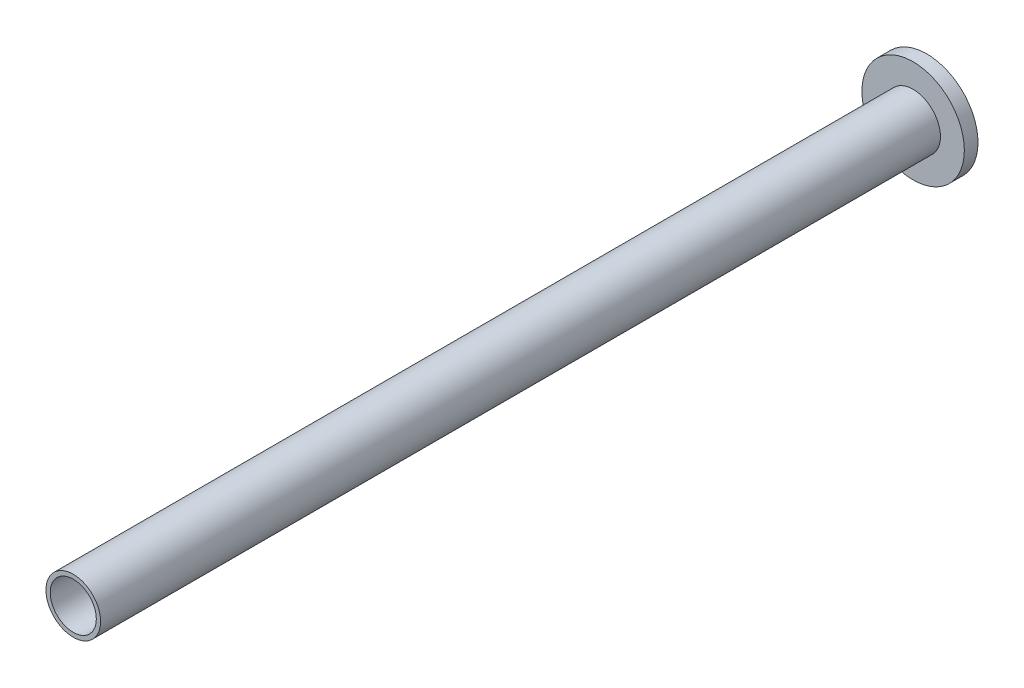
from build123d import *

# Parameters (mm, degrees)
EXTRUDE_START        = 300
EXTRUDE_SKETCH_1_R   = 30
EXTRUDE_1_DEPTH      = 8
EXTRUDE_START_2      = 308
EXTRUDE_SKETCH_2_R   = 16
EXTRUDE_SKETCH_2_R_2 = 13.5
EXTRUDE_2_DEPTH      = 492


with BuildPart() as part:
    # Extrude sketch 1 → Extrude 1 (new body)
    with BuildSketch(Plane.XY.offset(EXTRUDE_START)):
        with Locations((860, 225)):
            Circle(EXTRUDE_SKETCH_1_R)
    extrude(amount=EXTRUDE_1_DEPTH)


with BuildPart() as body_2:
    # Extrude sketch 2 → Extrude 2 (new body)
    with BuildSketch(Plane.XY.offset(EXTRUDE_START_2)):
        with Locations((860, 225)):
            Circle(EXTRUDE_SKETCH_2_R)
        with Locations((860, 225)):
            Circle(EXTRUDE_SKETCH_2_R_2, mode=Mode.SUBTRACT)
    extrude(amount=EXTRUDE_2_DEPTH)


with BuildPart() as part_1:
    add(part.part)

    # Combine (weld / assembly of features): union body 2
    add(body_2.part)


solid = part_1.part
